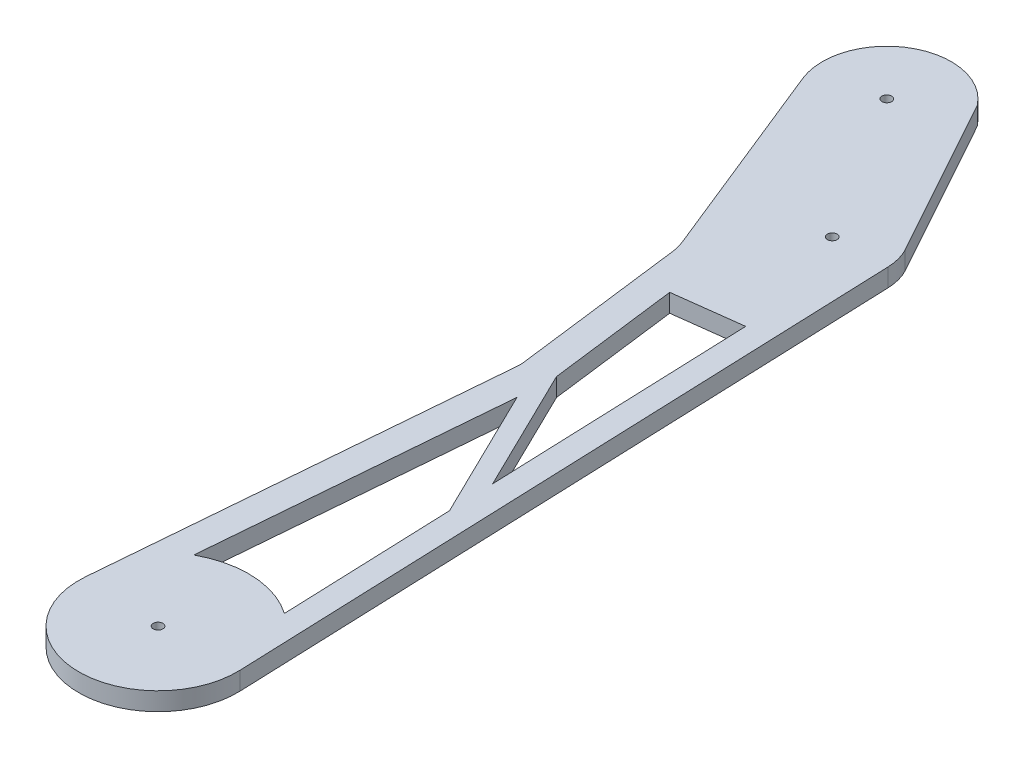
from build123d import *

# Parameters (mm, degrees)
SKETCH1_R           = 0.8509
BOSS_EXTRUDE3_DEPTH = 3.175


with BuildPart() as part:
    # Sketch1 → Boss-Extrude3 (new body)
    # profile 1 of 2: a face of its own
    with BuildSketch(Plane(origin=(0, 0, 0), x_dir=(1, 0, 0), z_dir=(0, 1, 0))):
        with BuildLine():
            Line((-26.618355099, 139.499410737), (-12.357546713, 104.145756125))
            ThreePointArc((-12.357546713, 104.145756125), (-11.974349365, 102.985269848), (-11.743579527, 101.785139069))
            Line((-11.743579527, 101.785139069), (-7.99527824, 72.072064446))
            ThreePointArc((-7.99527824, 72.072064446), (-7.946716363, 71.409174189), (-7.967711413, 70.744839217))
            Line((-7.967711413, 70.744839217), (-13.823023592, 1.163211045))
            ThreePointArc((-13.823023592, 1.163211045), (-0.322101588, -13.868139447), (13.862122414, 0.520195482))
            Line((13.862122414, 0.520195482), (11.138065029, 73.110631708))
            Line((11.138065029, 73.110631708), (9.439411602, 118.376195482))
            ThreePointArc((9.439411602, 118.376195482), (9.128634942, 120.450134843), (8.367932415, 122.40439641))
            Line((8.367932415, 122.40439641), (-7.278206254, 150.703639796))
            ThreePointArc((-7.278206254, 150.703639796), (-21.808106397, 153.490299925), (-26.618355099, 139.499410737))
        make_face()
        with Locations(Location((0, 0, 0), (0, 0, 270))):
            Circle(SKETCH1_R, mode=Mode.SUBTRACT)
        with Locations(Location((0, 118.021968393, 0), (0, 0, 270))):
            Circle(SKETCH1_R, mode=Mode.SUBTRACT)
        with Locations(Location((-16.149303345, 143.722372767, 0), (0, 0, 270))):
            Circle(SKETCH1_R, mode=Mode.SUBTRACT)
        with BuildLine():
            ThreePointArc((-2.955223154, 72.707866873), (-2.867811775, 71.514664411), (-2.905602865, 70.318861461))
            Line((-2.905602865, 70.318861461), (-7.652524964, 13.908791704))
            ThreePointArc((-7.652524964, 13.908791704), (0.876701263, 15.850773479), (9.139736464, 12.98001704))
            Line((9.139736464, 12.98001704), (5.991360589, 96.877654221))
            Line((5.991360589, 96.877654221), (-5.816334076, 95.388114762))
            Line((-5.816334076, 95.388114762), (-2.955223154, 72.707866873))
        make_face(mode=Mode.SUBTRACT)
    # profile 2 of 2: a face of its own
    with BuildSketch(Plane(origin=(0, 0, 0), x_dir=(1, 0, 0), z_dir=(0, 1, 0))):
        with BuildLine():
            Line((7.71861106, 50.850039017), (-2.955223154, 72.707866873))
            ThreePointArc((-2.955223154, 72.707866873), (-2.867811775, 71.514664411), (-2.905602865, 70.318861461))
            Line((-2.905602865, 70.318861461), (-3.260786549, 66.098034587))
            Line((-3.260786549, 66.098034587), (8.012738289, 43.012163072))
            Line((8.012738289, 43.012163072), (7.71861106, 50.850039017))
        make_face()
    extrude(amount=BOSS_EXTRUDE3_DEPTH)


solid = part.part
